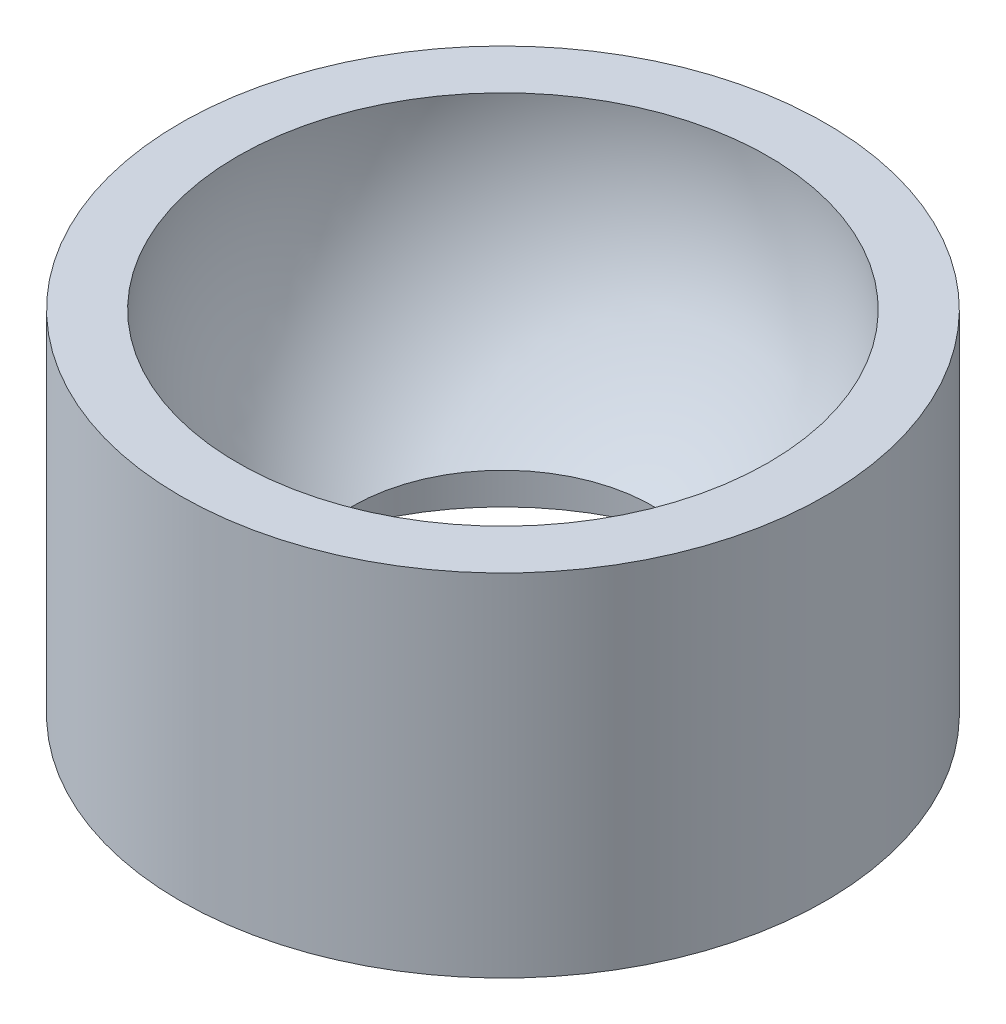
from build123d import *

# Parameters (mm, degrees)
SKETCH1_R           = 92
BOSS_EXTRUDE1_DEPTH = 100
SKETCH3_R           = 72.5
CUT_EXTRUDE1_DEPTH  = 30


with BuildPart() as part:
    # Sketch1 → Boss-Extrude1 (new body)
    with BuildSketch(Plane(origin=(0, 0, 0), x_dir=(1, 0, 0), z_dir=(0, 1, 0))):
        with Locations(Location((0, 0, 0), (0, 0, 270))):
            Circle(SKETCH1_R)
    extrude(amount=BOSS_EXTRUDE1_DEPTH)

    # Sketch2 → Cut-Revolve1 (revolve, cut)
    with BuildSketch(Plane.XY):
        with BuildLine():
            Line((0, 16.744424028), (0, 168.744424028))
            ThreePointArc((0, 168.744424028), (-76, 92.744424028), (0, 16.744424028))
        make_face()
    revolve(axis=Axis((0, 16.744424028, 0), (0, 1, 0)), mode=Mode.SUBTRACT)

    # Sketch3 → Cut-Extrude1 (cut)
    with BuildSketch(Plane.XZ):
        with Locations(Location((0, 0, 0), (0, 0, 270))):
            Circle(SKETCH3_R)
    extrude(amount=-CUT_EXTRUDE1_DEPTH, mode=Mode.SUBTRACT)


solid = part.part
